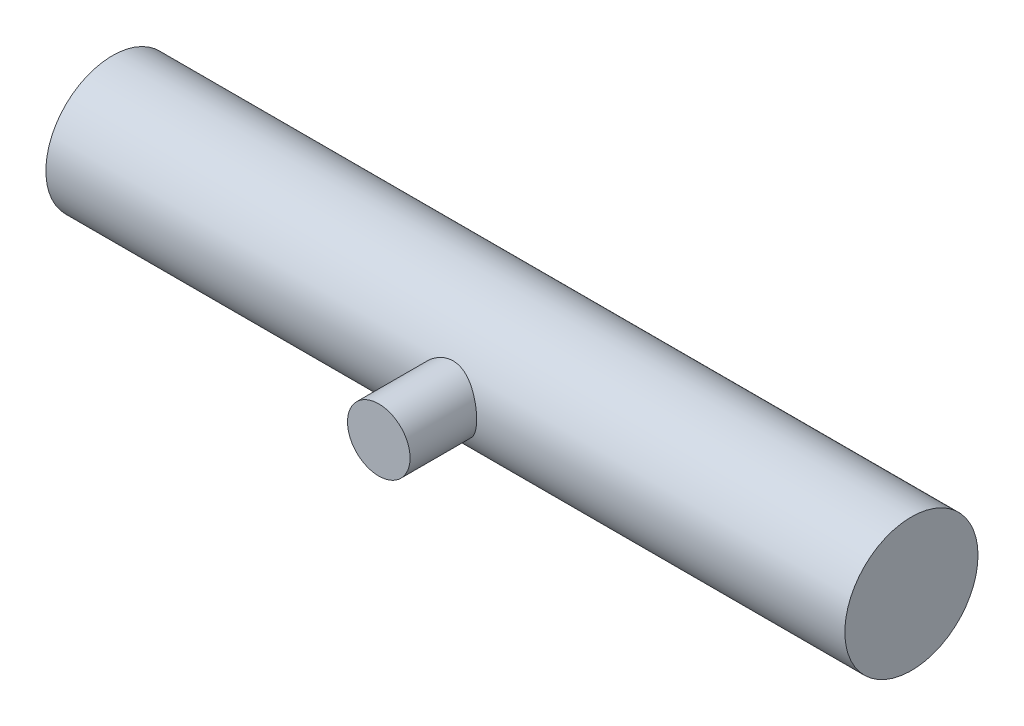
from build123d import *

# Parameters (mm, degrees)
SKETCH_1_R      = 5
EXTRUDE_1_DEPTH = 30
SKETCH_2_R      = 2.35
EXTRUDE_2_DEPTH = 10


with BuildPart() as part:
    # 草图1 → 凸台-拉伸1 (new, symmetric)
    with BuildSketch(Plane(origin=(0, 0, 0), x_dir=(0, 0, -1), z_dir=(1, 0, 0))):
        Circle(SKETCH_1_R)
    extrude(amount=EXTRUDE_1_DEPTH, both=True)

    # 草图2 → 凸台-拉伸2 (add)
    with BuildSketch(Plane.XY):
        Circle(SKETCH_2_R)
    extrude(amount=EXTRUDE_2_DEPTH)


solid = part.part
